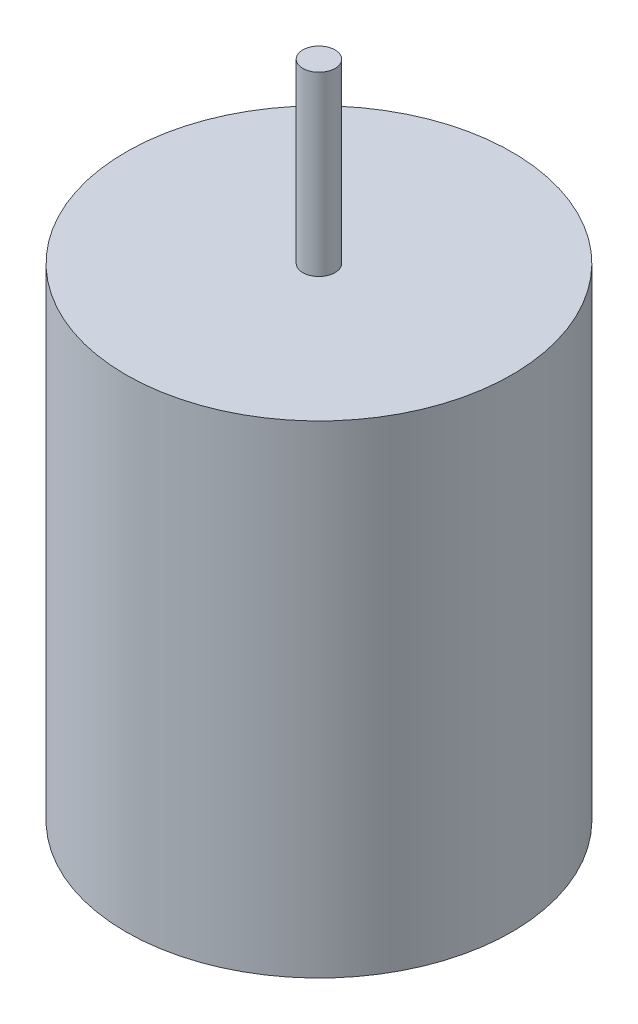
from build123d import *

# Parameters (mm, degrees)
SKETCH1_R           = 12
BOSS_EXTRUDE1_DEPTH = 30
SKETCH2_R           = 1
BOSS_EXTRUDE2_DEPTH = 11


with BuildPart() as part:
    # Sketch1 → Boss-Extrude1 (new body)
    with BuildSketch(Plane(origin=(0, 0, 0), x_dir=(1, 0, 0), z_dir=(0, 1, 0))):
        with Locations(Location((0, 0, 0), (0, 0, 270))):
            Circle(SKETCH1_R)
    extrude(amount=BOSS_EXTRUDE1_DEPTH)

    # Sketch2 → Boss-Extrude2 (add)
    with BuildSketch(Plane(origin=(0, 30, 0), x_dir=(1, 0, 0), z_dir=(0, 1, 0))):
        with Locations(Location((0, 0, 0), (0, 0, 270))):
            Circle(SKETCH2_R)
    extrude(amount=BOSS_EXTRUDE2_DEPTH)


solid = part.part
